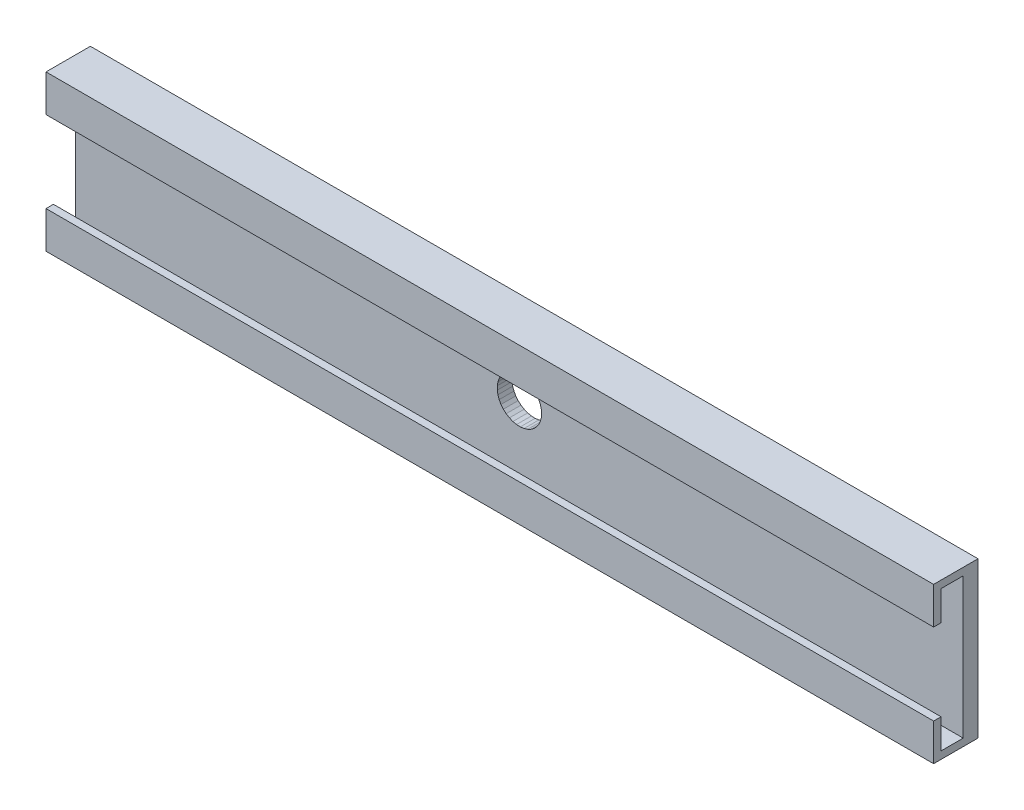
from build123d import *

# Parameters (mm, degrees)
SKETCH1_W           = 59.999998659
SKETCH1_H           = 10.499999858
BOSS_EXTRUDE1_DEPTH = 3.000000026
CUT_EXTRUDE1_DEPTH  = 61.985652708
CUT_EXTRUDE2_DEPTH  = 61.944645671


with BuildPart() as part:
    # Sketch1 → Boss-Extrude1 (new body)
    with BuildSketch(Plane(origin=(0, 0, 0), x_dir=(-1, 0, 0), z_dir=(0, 0, -1))):
        with Locations((-29.99999933, 5.249999929)):
            Rectangle(SKETCH1_W, SKETCH1_H)
    extrude(amount=-BOSS_EXTRUDE1_DEPTH)

    # Sketch2 → Cut-Extrude1 (cut, through all)
    with BuildSketch(Plane.ZY):
        Polygon((3.000000026, 2.499999944), (3.000000026, 8.00000038), (2.499999944, 8.00000038), (2.499999944, 9.999999776), (1.000000047, 9.999999776), (1.000000047, 0.500000024), (2.499999944, 0.500000024), (2.499999944, 2.499999944), align=None)
    extrude(amount=-CUT_EXTRUDE1_DEPTH, mode=Mode.SUBTRACT)

    # Sketch3 → Cut-Extrude2 (cut, through all)
    with BuildSketch(Plane.XY.offset(1.000000047)):
        Polygon((30.559284613, 6.641833577), (30.316019431, 6.716332864), (30.063662678, 6.74864836), (29.809473082, 6.737850606), (29.560763389, 6.684250198), (29.324693605, 6.58938894), (29.108049348, 6.455995608), (28.917066753, 6.287908182), (28.757235035, 6.089962088), (28.633158654, 5.867851898), (28.548400849, 5.627966952), (28.505403548, 5.377208814), (28.505403548, 5.122791044), (28.548400849, 4.872032907), (28.633158654, 4.63214796), (28.757235035, 4.410037771), (28.917066753, 4.212091677), (29.108049348, 4.04400425), (29.324693605, 3.910611384), (29.560763389, 3.815749893), (29.809473082, 3.762149252), (30.063662678, 3.751351498), (30.316019431, 3.783667227), (30.559284613, 3.858166514), (30.786460266, 3.972706385), (30.991012231, 4.123991355), (31.167054549, 4.307670053), (31.309522688, 4.518457688), (31.414315104, 4.75029042), (31.478423625, 4.996498581), (31.500000507, 5.249999929), (31.478423625, 5.503501277), (31.414315104, 5.749709904), (31.309522688, 5.981542636), (31.167054549, 6.192329805), (30.991012231, 6.376008503), (30.786460266, 6.527293939), align=None)
    extrude(amount=-CUT_EXTRUDE2_DEPTH, mode=Mode.SUBTRACT)


solid = part.part
